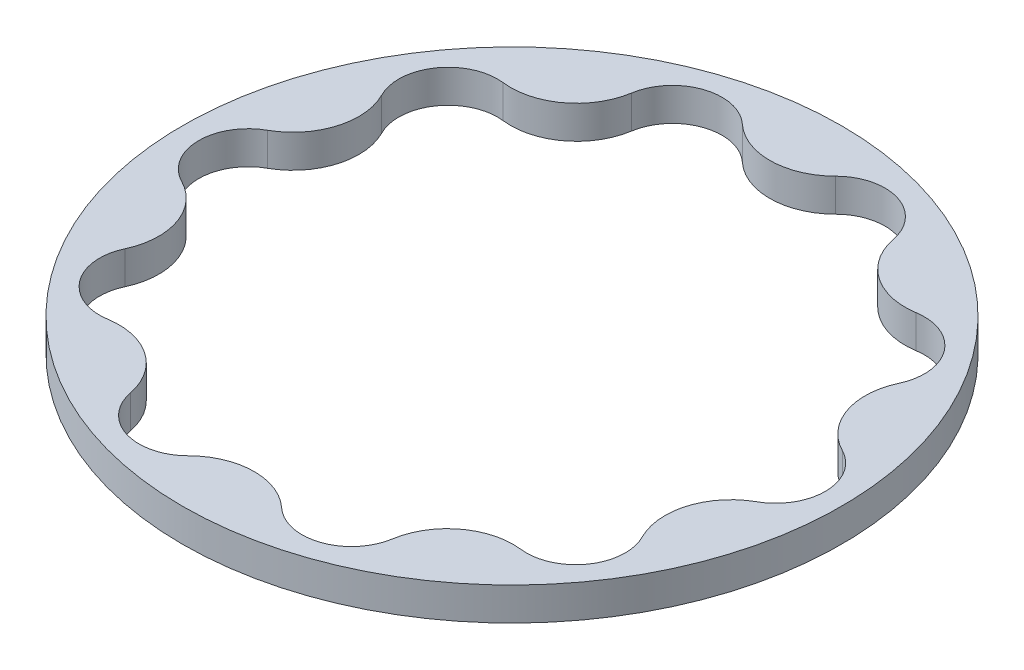
from build123d import *

# Parameters (mm, degrees)
SKETCH1_R           = 100
BOSS_EXTRUDE1_DEPTH = 10


with BuildPart() as part:
    # Sketch1 → Boss-Extrude1 (new body)
    with BuildSketch(Plane(origin=(0, 0, 0), x_dir=(1, 0, 0), z_dir=(0, 1, 0))):
        with Locations(Location((0, 0, 0), (0, 0, 270))):
            Circle(SKETCH1_R)
        with BuildLine():
            ThreePointArc((-40.455763136, 76.710865294), (-30.532781322, 88.532885217), (-15.431871826, 85.340980525))
            ThreePointArc((-15.431871826, 85.340980525), (-1.435318351, 79.986408862), (12.360115413, 85.839694617))
            ThreePointArc((12.360115413, 85.839694617), (27.336785299, 89.571327274), (37.677523206, 78.112930236))
            ThreePointArc((37.677523206, 78.112930236), (45.853634574, 65.554023048), (60.454849979, 62.180678181))
            ThreePointArc((60.454849979, 62.180678181), (74.764629078, 56.396566729), (76.395384986, 41.048395558))
            ThreePointArc((76.395384986, 41.048395558), (75.6280576, 26.082228528), (85.457886638, 14.770756123))
            ThreePointArc((85.457886638, 14.770756123), (93.634925706, 1.680234544), (85.932806285, -11.69523104))
            ThreePointArc((85.932806285, -11.69523104), (76.515133126, -23.352090786), (77.818915207, -38.281092734))
            ThreePointArc((77.818915207, -38.281092734), (76.739863248, -53.677890129), (62.646816331, -59.971676886))
            ThreePointArc((62.646816331, -59.971676886), (48.176028451, -63.866705129), (40.455763136, -76.710865294))
            ThreePointArc((40.455763136, -76.710865294), (30.532781322, -88.532885217), (15.431871826, -85.340980525))
            ThreePointArc((15.431871826, -85.340980525), (1.435318351, -79.986408862), (-12.360115413, -85.839694617))
            ThreePointArc((-12.360115413, -85.839694617), (-27.336785299, -89.571327274), (-37.677523206, -78.112930236))
            ThreePointArc((-37.677523206, -78.112930236), (-45.853634574, -65.554023048), (-60.454849979, -62.180678181))
            ThreePointArc((-60.454849979, -62.180678181), (-74.764629078, -56.396566729), (-76.395384986, -41.048395558))
            ThreePointArc((-76.395384986, -41.048395558), (-75.6280576, -26.082228528), (-85.457886638, -14.770756123))
            ThreePointArc((-85.457886638, -14.770756123), (-93.634925706, -1.680234544), (-85.932806285, 11.69523104))
            ThreePointArc((-85.932806285, 11.69523104), (-76.515133126, 23.352090786), (-77.818915207, 38.281092734))
            ThreePointArc((-77.818915207, 38.281092734), (-76.739863248, 53.677890129), (-62.646816331, 59.971676886))
            ThreePointArc((-62.646816331, 59.971676886), (-48.176028451, 63.866705129), (-40.455763136, 76.710865294))
        make_face(mode=Mode.SUBTRACT)
    extrude(amount=BOSS_EXTRUDE1_DEPTH)


solid = part.part
